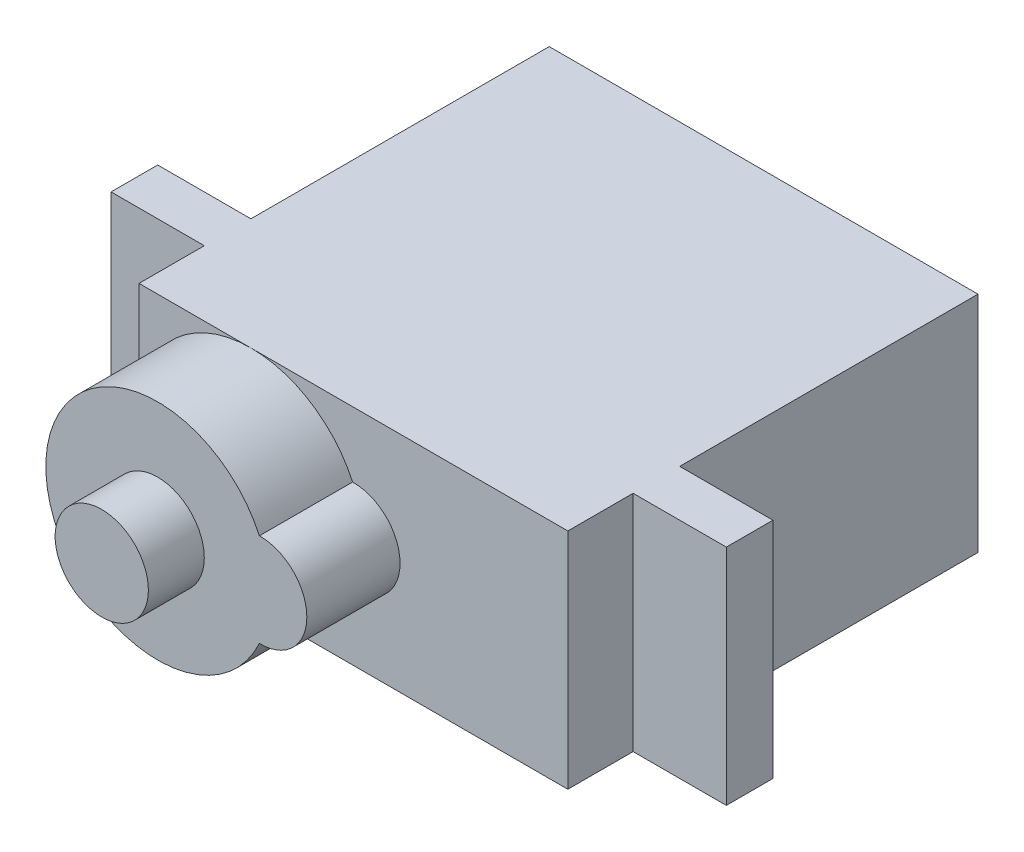
from build123d import *

# Parameters (mm, degrees)
ESQUISSE1_W        = 23
ESQUISSE1_H        = 12
BOSS_EXTRU_1_DEPTH = 22
ESQUISSE2_R        = 2.5
ESQUISSE2_R_2      = 6
BOSS_EXTRU_2_DEPTH = 5
ESQUISSE3_R        = 2.5
BOSS_EXTRU_3_DEPTH = 3
ESQUISSE4_W        = 2.5
ESQUISSE4_H        = 12
BOSS_EXTRU_4_DEPTH = 5


with BuildPart() as part:
    # Esquisse1 → Boss.-Extru.1 (new body)
    with BuildSketch(Plane.XY):
        Rectangle(ESQUISSE1_W, ESQUISSE1_H)
    extrude(amount=BOSS_EXTRU_1_DEPTH)

    # Esquisse2 → Boss.-Extru.2 (add)
    with BuildSketch(Plane.XY.offset(22)):
        Circle(ESQUISSE2_R)
        with Locations((-5.5, 0)):
            Circle(ESQUISSE2_R_2)
    extrude(amount=BOSS_EXTRU_2_DEPTH)

    # Esquisse3 → Boss.-Extru.3 (add)
    with BuildSketch(Plane.XY.offset(27)):
        with Locations((-5.5, 0)):
            Circle(ESQUISSE3_R)
    extrude(amount=BOSS_EXTRU_3_DEPTH)

    # Esquisse4 → Boss.-Extru.4 (add)
    with BuildSketch(Plane.ZY.offset(11.5)):
        with Locations((17.25, 0)):
            Rectangle(ESQUISSE4_W, ESQUISSE4_H)
    boss_extru_4 = extrude(amount=BOSS_EXTRU_4_DEPTH)

    # Symétrie1: Boss.-Extru.4 across plane
    add(boss_extru_4.mirror(Plane(origin=(0, 0, 0), x_dir=(0, 0, 1), z_dir=(1, 0, 0))))


solid = part.part
